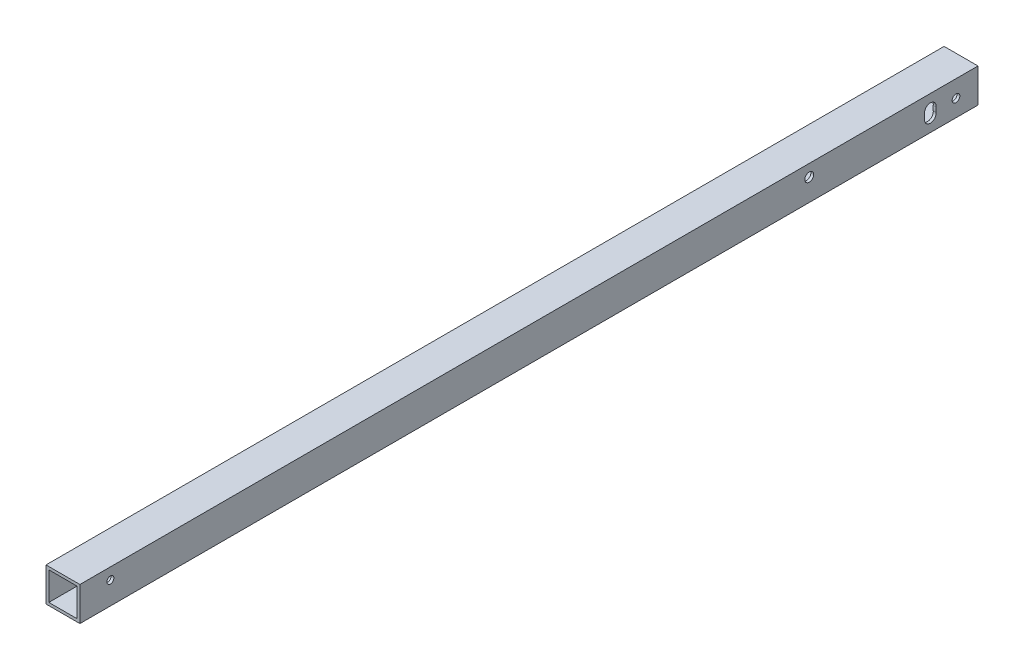
from build123d import *

# Parameters (mm, degrees)
SKETCH2_R                       = 5.1435
SKETCH2_R_2                     = 3.175
BOSS_EXTRUDE1_DEPTH             = 9.525
SKETCH3_W                       = 504.825
SKETCH3_H                       = 19.05
BOSS_EXTRUDE2_DEPTH             = 19.05
BOSS_EXTRUDE4_START             = 0.9525
SKETCH5_R                       = 2.3622
BOSS_EXTRUDE4_DEPTH             = 4.7625
CUT_EXTRUDE6_DEPTH              = 643.110605912
SKETCH13_W                      = 2.4892
SKETCH13_H                      = 24.765
F_10_CLEARANCE_HOLE1_AT_2_COUNT = 2
F_10_CLEARANCE_HOLE1_AT_2_PITCH = 107.93330862
F_10_CLEARANCE_HOLE1_AT_3_COUNT = 2
F_10_CLEARANCE_HOLE1_AT_3_PITCH = 50.83905952
SKETCH19_W                      = 2.15265
SKETCH19_H                      = 24.765
F_8_CLEARANCE_HOLE1_AT_2_COUNT  = 2
F_8_CLEARANCE_HOLE1_AT_2_PITCH  = 14.538502572
SKETCH21_W                      = 15.875
SKETCH21_H                      = 15.875
CUT_EXTRUDE5_DEPTH              = 645.986539181
FILLET1_R                       = 2.032
FILLET2_R                       = 3.175
FILLET3_R                       = 7.62
CUT_EXTRUDE8_REACH              = 510.714
SKETCH24_R                      = 1.9812
CUT_EXTRUDE12_REACH             = 510.714
SKETCH29_R                      = 3.937


with BuildPart() as part:
    # Sketch2 → Boss-Extrude1 (new, symmetric)
    with BuildSketch(Plane(origin=(0, 0, 0), x_dir=(0, 0, -1), z_dir=(1, 0, 0))):
        with BuildLine():
            Line((0, 0), (0, 19.05))
            Line((0, 19.05), (5.08, 19.05))
            Line((5.08, 19.05), (5.08, 9.12002091))
            ThreePointArc((5.08, 9.12002091), (8.240423276, 4.635073149), (13.527141803, 6.102601311))
            Line((13.527141803, 6.102601311), (24.13, 19.05))
            Line((24.13, 19.05), (641.35, 19.05))
            Line((641.35, 19.05), (641.35, 0))
            Line((641.35, 0), (0, 0))
        make_face()
        with Locations(Location((60.6425, 11.1125, 0), (0, 0, 180))):
            Circle(SKETCH2_R, mode=Mode.SUBTRACT)
        with Locations(Location((111.4425, 10.744324516, 0), (0, 0, 180))):
            Circle(SKETCH2_R_2, mode=Mode.SUBTRACT)
    extrude(amount=BOSS_EXTRUDE1_DEPTH, both=True)


with BuildPart() as body_2:
    # Sketch3 → Boss-Extrude2 (new body)
    with BuildSketch(Plane(origin=(9.525, 0, 0), x_dir=(0, 0, -1), z_dir=(1, 0, 0))):
        with Locations((-255.5875, 9.525)):
            Rectangle(SKETCH3_W, SKETCH3_H)
        with BuildLine():
            ThreePointArc((-26.750669413, 10.846231772), (-29.598950711, 14.455649526), (-33.208368465, 11.607368228))
            ThreePointArc((-33.208368465, 11.607368228), (-33.330664319, 9.525), (-33.208368465, 7.442631772))
            ThreePointArc((-33.208368465, 7.442631772), (-29.598950711, 4.594350474), (-26.750669413, 8.203768228))
            ThreePointArc((-26.750669413, 8.203768228), (-26.828264319, 9.525), (-26.750669413, 10.846231772))
        make_face(mode=Mode.SUBTRACT)
    extrude(amount=-BOSS_EXTRUDE2_DEPTH)


with BuildPart() as body_3:
    # Sketch5 → Boss-Extrude4 (new body)
    with BuildSketch(Plane(origin=(9.525, 0, 0), x_dir=(0, 0, -1), z_dir=(1, 0, 0)).offset(BOSS_EXTRUDE4_START)):
        with BuildLine():
            Line((-109.232195108, 19.05), (-109.232195108, 0))
            Line((-109.232195108, 0), (127.635, 0))
            Line((127.635, 0), (127.635, 8.314107432))
            Line((127.635, 8.314107432), (127.635, 19.05))
            Line((127.635, 19.05), (116.205, 19.05))
            Line((116.205, 19.05), (114.64451478, 10.1809394))
            ThreePointArc((114.64451478, 10.1809394), (111.768043442, 7.509463946), (108.416949201, 9.554222083))
            Line((108.416949201, 9.554222083), (106.68, 13.97))
            Line((106.68, 13.97), (100.6475, 13.97))
            Line((100.6475, 13.97), (100.6475, 19.05))
            Line((100.6475, 19.05), (-92.691910554, 19.05))
            ThreePointArc((-92.691910554, 19.05), (-93.03686413, 15.638889171), (-93.231074764, 12.215885769))
            ThreePointArc((-93.231074764, 12.215885769), (-98.208104423, 7.572084572), (-102.85190562, 12.549114231))
            ThreePointArc((-102.85190562, 12.549114231), (-102.678331807, 15.803927129), (-102.383466098, 19.05))
            Line((-102.383466098, 19.05), (-109.232195108, 19.05))
        make_face()
        with Locations(Location((-15.540961747, 9.525, 0), (0, 0, 180))):
            Circle(SKETCH5_R, mode=Mode.SUBTRACT)
    extrude(amount=BOSS_EXTRUDE4_DEPTH)

    # Sketch22 → Cut-Extrude6 (cut, through all)
    with BuildSketch(Plane(origin=(15.24, 0, 0), x_dir=(0, 0, -1), z_dir=(1, 0, 0))):
        Polygon((-93.370680711, 11.220004545), (-91.421910554, 19.05), (-97.537688326, 22.971636797), (-103.653466098, 19.05), (-109.232195108, 19.05), (-109.232195108, 17.78), (-103.507382665, 17.78), (-102.823260211, 11.832470568), align=None)
    extrude(amount=-CUT_EXTRUDE6_DEPTH, mode=Mode.SUBTRACT)

    # Sketch13 → #10 Clearance Hole1 (revolve, cut)
    with BuildSketch(Plane(origin=(15.24, 9.12002091, -9.8425), x_dir=(0, 0, -1), z_dir=(0, 1, 0))):
        with Locations((1.2446, 12.3825)):
            Rectangle(SKETCH13_W, SKETCH13_H)
    f_10_clearance_hole1 = revolve(axis=Axis((21.59, 9.12002091, -9.8425), (-1, 0, 0)), mode=Mode.SUBTRACT)

    # #10 Clearance Hole1 at 3: #10 Clearance Hole1 ×2
    with Locations(*[Vector(0, 0.03919189515398232, -0.9992317025366236) * (i * F_10_CLEARANCE_HOLE1_AT_3_PITCH) for i in range(1, F_10_CLEARANCE_HOLE1_AT_3_COUNT)]):
        add(f_10_clearance_hole1, mode=Mode.SUBTRACT)

    # Sketch19 → #8 Clearance Hole1 (revolve, cut)
    with BuildSketch(Plane(origin=(15.24, 11.2268, 29.979518939), x_dir=(0, 0, -1), z_dir=(0, 1, 0))):
        with Locations((1.076325, 12.3825)):
            Rectangle(SKETCH19_W, SKETCH19_H)
    f_8_clearance_hole1 = revolve(axis=Axis((21.59, 11.2268, 29.979518939), (-1, 0, 0)), mode=Mode.SUBTRACT)

    # Fillet1
    fillet1_edges = [body_3.edges().sort_by_distance(p)[0] for p in [
        (12.85875, 13.97, -106.68),
        (12.85875, 19.05, -116.205),
        (12.85875, 19.05, -127.635),
        (12.85875, 0, -127.635),
        (12.85875, 17.78, 109.232195108),
        (12.85875, 17.78, 103.507382665),
        (12.85875, 19.05, 91.421910554),
    ]]
    fillet(fillet1_edges, radius=FILLET1_R)

    # Fillet2
    fillet2_edges = [body_3.edges().sort_by_distance(p)[0] for p in [
        (12.85875, 13.97, -100.6475),
    ]]
    fillet(fillet2_edges, radius=FILLET2_R)

    # Fillet3
    fillet3_edges = [body_3.edges().sort_by_distance(p)[0] for p in [
        (12.85875, 19.05, -100.6475),
    ]]
    fillet(fillet3_edges, radius=FILLET3_R)


with BuildPart() as body_2_1:
    add(body_2.part)

    # #10 Clearance Hole1 at 2: #10 Clearance Hole1 ×2
    with Locations(*[Vector(0, 0.030226805164900904, 0.9995430657302982) * (i * F_10_CLEARANCE_HOLE1_AT_2_PITCH) for i in range(1, F_10_CLEARANCE_HOLE1_AT_2_COUNT)]):
        add(f_10_clearance_hole1, mode=Mode.SUBTRACT)

    # #8 Clearance Hole1 at 2: #8 Clearance Hole1 ×2
    with Locations(*[Vector(0, -0.11705469608097882, -0.9931254694777442) * (i * F_8_CLEARANCE_HOLE1_AT_2_PITCH) for i in range(1, F_8_CLEARANCE_HOLE1_AT_2_COUNT)]):
        add(f_8_clearance_hole1, mode=Mode.SUBTRACT)

    # Sketch21 → Cut-Extrude5 (cut, through all)
    with BuildSketch(Plane(origin=(0, 0, 3.175), x_dir=(-1, 0, 0), z_dir=(0, 0, -1))):
        with Locations((0, 9.525)):
            Rectangle(SKETCH21_W, SKETCH21_H)
    extrude(amount=-CUT_EXTRUDE5_DEPTH, mode=Mode.SUBTRACT)

    # Sketch24 → Cut-Extrude8 (cut, up to next)
    with BuildSketch(Plane(origin=(9.525, 0, 0), x_dir=(0, 0, -1), z_dir=(1, 0, 0)), mode=Mode.PRIVATE) as cut_extrude8_sk1:
        with Locations((-490.855, 12.7)):
            Circle(SKETCH24_R)
    cut_extrude8_tool1 = extrude(cut_extrude8_sk1.sketch, amount=-CUT_EXTRUDE8_REACH, mode=Mode.PRIVATE) & body_2_1.part
    add(cut_extrude8_tool1.solids().sort_by_distance((9.525, 12.7, 490.855))[0], mode=Mode.SUBTRACT)

    # Sketch29 → Cut-Extrude12 (cut, up to next)
    with BuildSketch(Plane.ZY.offset(9.525), mode=Mode.PRIVATE) as cut_extrude12_sk1:
        with Locations((490.855, 12.7)):
            Circle(SKETCH29_R)
    cut_extrude12_tool1 = extrude(cut_extrude12_sk1.sketch, amount=-CUT_EXTRUDE12_REACH, mode=Mode.PRIVATE) & body_2_1.part
    add(cut_extrude12_tool1.solids().sort_by_distance((-9.525, 12.7, 490.855))[0], mode=Mode.SUBTRACT)


solid = body_2_1.part
